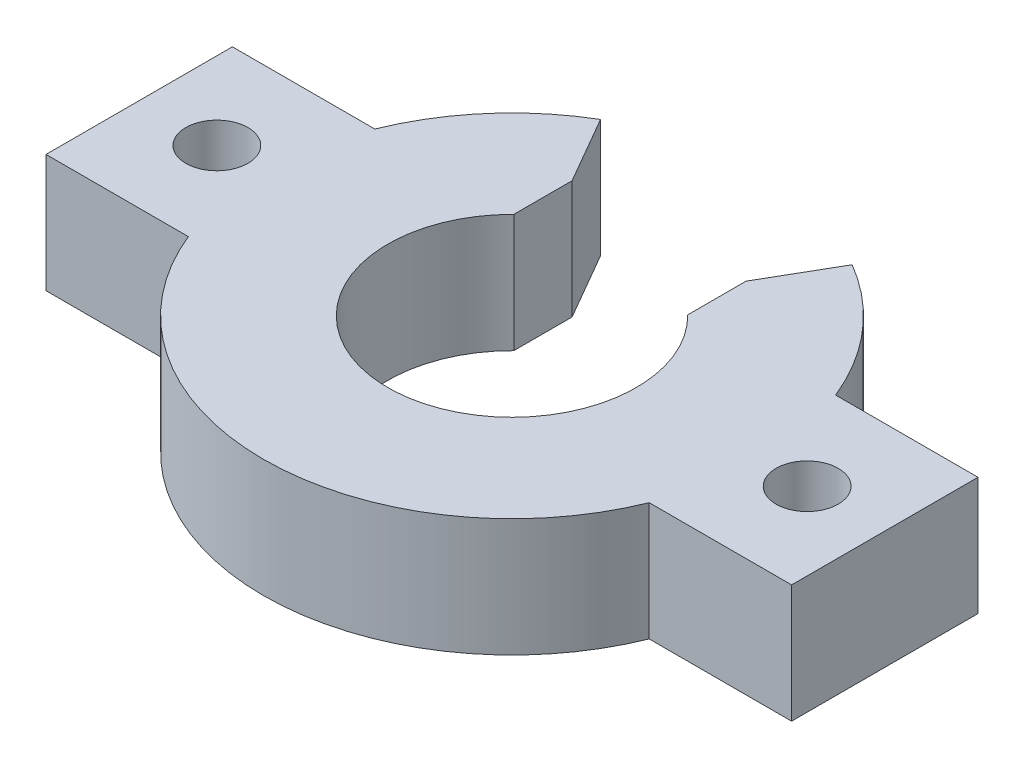
from build123d import *

# Parameters (mm, degrees)
SKETCH_1_R          = 8
SKETCH_1_R_2        = 4
EXTRUDE_1_DEPTH     = 3.8
SKETCH_4_W          = 6
SKETCH_4_H          = 6
EXTRUDE_2_DEPTH     = 3.8
SKETCH_5_R          = 2
CUT_EXTRUDE_3_DEPTH = 1
SKETCH_6_R          = 1
CUT_EXTRUDE_4_DEPTH = 15.691494138
CUT_EXTRUDE_5_DEPTH = 15.91442255


with BuildPart() as part:
    # 草图1 → 凸台-拉伸1 (new body)
    with BuildSketch(Plane(origin=(0, 0, 0), x_dir=(1, 0, 0), z_dir=(0, 1, 0))):
        with Locations(Location((0, 0, 0), (0, 0, 90))):
            Circle(SKETCH_1_R)
        with Locations(Location((0, 0, 0), (0, 0, 90))):
            Circle(SKETCH_1_R_2, mode=Mode.SUBTRACT)
    extrude(amount=EXTRUDE_1_DEPTH)

    # 草图4 → 凸台-拉伸2 (add)
    with BuildSketch(Plane(origin=(0, 3.8, 0), x_dir=(1, 0, 0), z_dir=(0, 1, 0))):
        with Locations((-9, 0)):
            Rectangle(SKETCH_4_W, SKETCH_4_H)
        with Locations((9, 0)):
            Rectangle(SKETCH_4_W, SKETCH_4_H)
    extrude(amount=-EXTRUDE_2_DEPTH)

    # 草图5 → 切除-拉伸3 (cut)
    with BuildSketch(Plane.XZ):
        with Locations(Location((-9.5, 0, 0), (0, 0, 270))):
            Circle(SKETCH_5_R)
        with Locations(Location((9.5, 0, 0), (0, 0, 90))):
            Circle(SKETCH_5_R)
    extrude(amount=-CUT_EXTRUDE_3_DEPTH, mode=Mode.SUBTRACT)

    # 草图6 → 切除-拉伸4 (cut, through all)
    with BuildSketch(Plane.XZ.offset(-1)):
        with Locations(Location((-9.5, 0, 0), (0, 0, 270))):
            Circle(SKETCH_6_R)
        with Locations(Location((9.5, 0, 0), (0, 0, 90))):
            Circle(SKETCH_6_R)
    extrude(amount=-CUT_EXTRUDE_4_DEPTH, mode=Mode.SUBTRACT)

    # 草图7 → 切除-拉伸5 (cut, through all)
    with BuildSketch(Plane(origin=(0, 3.8, 0), x_dir=(1, 0, 0), z_dir=(0, 1, 0))):
        with BuildLine():
            Line((-4.05, 6.899094143), (-2.8, 4.734030634))
            Line((-2.8, 4.734030634), (-2.8, 2.856571371))
            ThreePointArc((-2.8, 2.856571371), (0, 4), (2.8, 2.856571371))
            Line((2.8, 2.856571371), (2.8, 4.734030634))
            Line((2.8, 4.734030634), (4.05, 6.899094143))
            ThreePointArc((4.05, 6.899094143), (0, 8), (-4.05, 6.899094143))
        make_face()
    extrude(amount=-CUT_EXTRUDE_5_DEPTH, mode=Mode.SUBTRACT)


solid = part.part
